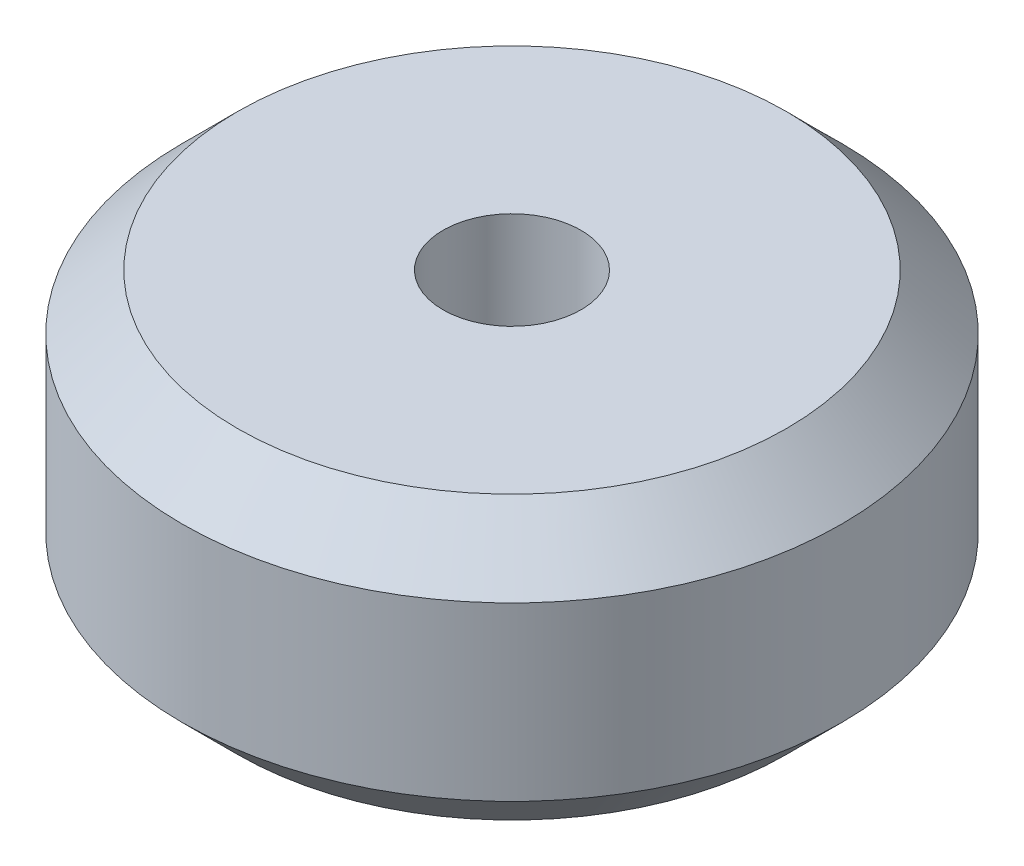
from build123d import *

# Parameters (mm, degrees)
SKETCH1_R           = 11.95
SKETCH1_R_2         = 7.985
BOSS_EXTRUDE1_DEPTH = 10.23
CHAMFER1_SIZE       = 2
SKETCH2_R           = 7.985
SKETCH2_R_2         = 2.5
BOSS_EXTRUDE3_DEPTH = 10.23


with BuildPart() as part:
    # Sketch1 → Boss-Extrude1 (new body)
    with BuildSketch(Plane(origin=(0, 0, 0), x_dir=(1, 0, 0), z_dir=(0, 1, 0))):
        with Locations(Location((0, 0, 0), (0, 0, 270))):
            Circle(SKETCH1_R)
        with Locations(Location((0, 0, 0), (0, 0, 270))):
            Circle(SKETCH1_R_2, mode=Mode.SUBTRACT)
    extrude(amount=BOSS_EXTRUDE1_DEPTH)

    # Chamfer1
    chamfer1_edges = [part.edges().sort_by_distance(p)[0] for p in [
        (0, 0, -11.95),
        (0, 10.23, -11.95),
    ]]
    chamfer(chamfer1_edges, length=CHAMFER1_SIZE)

    # Sketch2 → Boss-Extrude3 (add)
    with BuildSketch(Plane(origin=(0, 0, 0), x_dir=(1, 0, 0), z_dir=(0, 1, 0))):
        Circle(SKETCH2_R)
        with Locations(Location((0, 0, 0), (0, 0, 270))):
            Circle(SKETCH2_R_2, mode=Mode.SUBTRACT)
    extrude(amount=BOSS_EXTRUDE3_DEPTH)


solid = part.part
